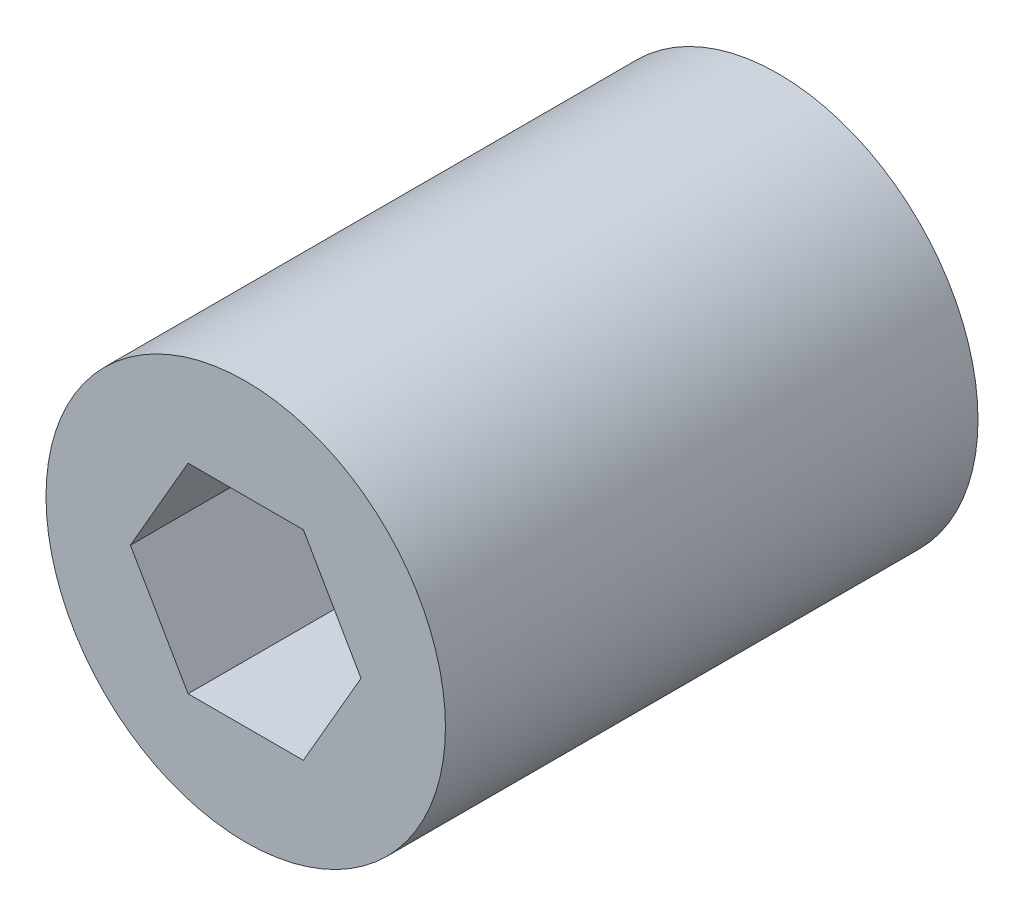
from build123d import *

# Parameters (mm, degrees)
S01_M3_HEADLESS_BODY_R       = 1.5
F_01_M3_HEADLESS_BODY_DEPTH  = 4
F_02_START                   = 2.8
F_02_1_5_MM_HEX_SOCKET_DEPTH = 1.3


with BuildPart() as part:
    # S01 - M3 headless body → 01 - M3 headless body (new body)
    with BuildSketch(Plane.XY):
        Circle(S01_M3_HEADLESS_BODY_R)
    extrude(amount=F_01_M3_HEADLESS_BODY_DEPTH)

    # S02 - 1.5 mm hex socket → 02 - 1.5 mm hex socket (cut)
    with BuildSketch(Plane.XY.offset(F_02_START)):
        Polygon((0.866025404, 0), (0.433012702, 0.75), (-0.433012702, 0.75), (-0.866025404, 0), (-0.433012702, -0.75), (0.433012702, -0.75), align=None)
    extrude(amount=F_02_1_5_MM_HEX_SOCKET_DEPTH, mode=Mode.SUBTRACT)


solid = part.part
